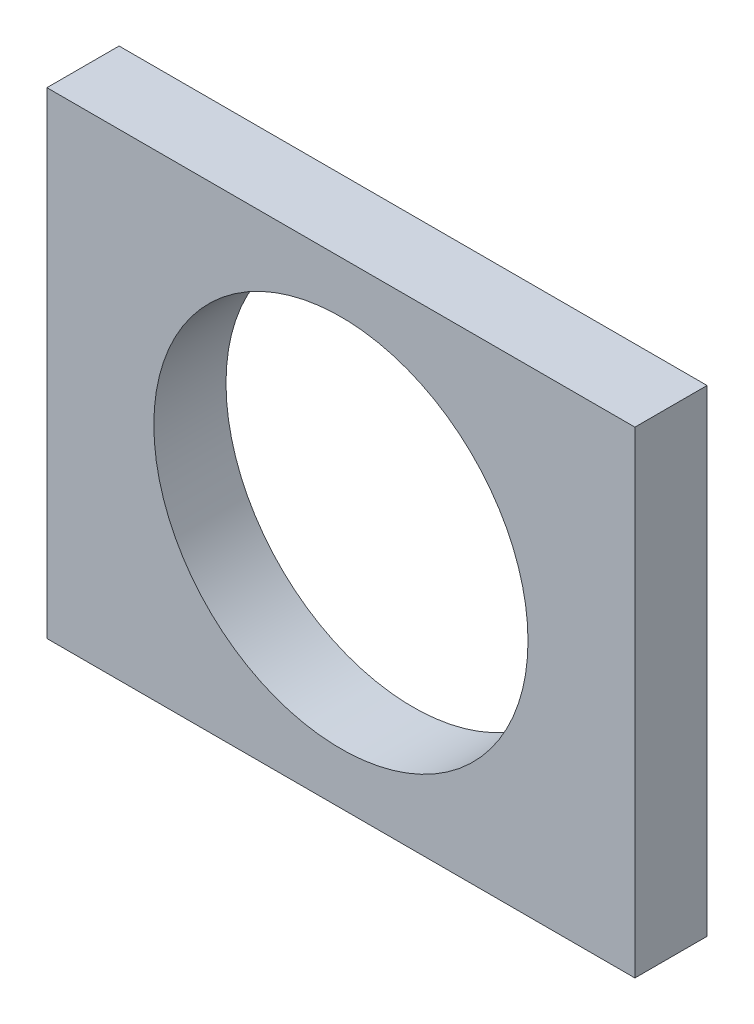
from build123d import *

# Parameters (mm, degrees)
CROQUIS1_W              = 44
CROQUIS1_H              = 35.7
CROQUIS1_R              = 14
SALIENTE_EXTRUIR1_DEPTH = 5.4


with BuildPart() as part:
    # Croquis1 → Saliente-Extruir1 (new body)
    with BuildSketch(Plane.XY):
        Rectangle(CROQUIS1_W, CROQUIS1_H)
        with Locations(Location((0, 0, 0), (0, 0, 180))):
            Circle(CROQUIS1_R, mode=Mode.SUBTRACT)
    extrude(amount=SALIENTE_EXTRUIR1_DEPTH)


solid = part.part
